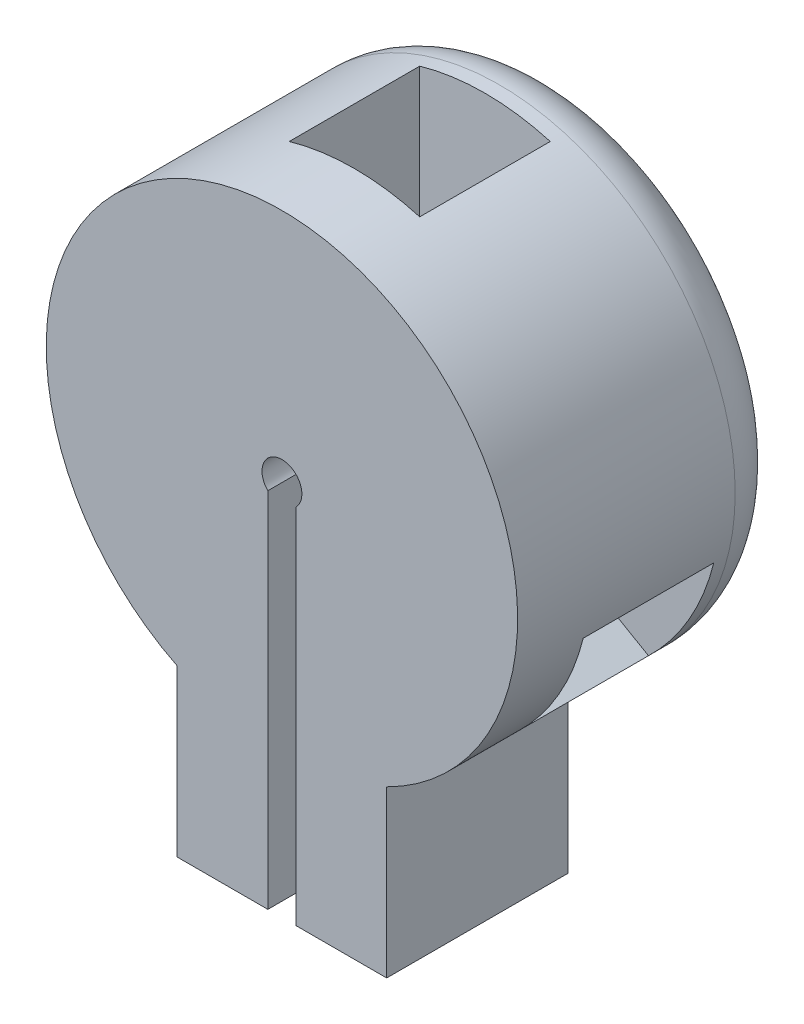
from build123d import *

# Parameters (mm, degrees)
BOSS_EXTRUDE1_DEPTH = 10
BOSS_EXTRUDE2_START = -5
SKETCH1_4_R         = 13
BOSS_EXTRUDE2_DEPTH = 5
FILLET1_R           = 3
SKETCH4_W           = 7.2
SKETCH4_H           = 7.2
CUT_EXTRUDE1_DEPTH  = 10
CIRPATTERN1_COUNT   = 3


with BuildPart() as part:
    # Sketch1 → Boss-Extrude1 (new body)
    with BuildSketch(Plane.XY):
        with BuildLine():
            Line((-5.777817459, -20.777817459), (-0.777817459, -20.777817459))
            Line((-0.777817459, -20.777817459), (-0.777817459, -0.777817459))
            ThreePointArc((-0.777817459, -0.777817459), (0, 1.1), (0.777817459, -0.777817459))
            Line((0.777817459, -0.777817459), (0.777817459, -20.777817459))
            Line((0.777817459, -20.777817459), (5.777817459, -20.777817459))
            Line((5.777817459, -20.777817459), (5.777817459, -11.645463727))
            ThreePointArc((5.777817459, -11.645463727), (0, 13), (-5.777817459, -11.645463727))
            Line((-5.777817459, -11.645463727), (-5.777817459, -20.777817459))
        make_face()
    extrude(amount=BOSS_EXTRUDE1_DEPTH)

    # Sketch1<4> → Boss-Extrude2 (add)
    with BuildSketch(Plane.XY.offset(BOSS_EXTRUDE2_START)):
        Circle(SKETCH1_4_R)
    extrude(amount=BOSS_EXTRUDE2_DEPTH)

    # Fillet1
    fillet1_edges = [part.edges().sort_by_distance(p)[0] for p in [
        (-13, 0, -5),
    ]]
    fillet(fillet1_edges, radius=FILLET1_R)

    # Sketch4 → Cut-Extrude1 (cut)
    with BuildSketch(Plane(origin=(-11.286443879, -6.451305765, 0), x_dir=(0.499999999999998, -0.8660254037844398, 0), z_dir=(0.8660254037844398, 0.499999999999998, 0))):
        with Locations((0.056227259, -2.4)):
            Rectangle(SKETCH4_W, SKETCH4_H)
    cut_extrude1 = extrude(amount=CUT_EXTRUDE1_DEPTH, mode=Mode.SUBTRACT)

    # CirPattern1: Cut-Extrude1 ×3 about axis
    cirpattern1_axis = Axis((0, 0, 10), (0, 0, -1))
    for i in range(1, CIRPATTERN1_COUNT):
        add(cut_extrude1.rotate(cirpattern1_axis, i * 360 / CIRPATTERN1_COUNT), mode=Mode.SUBTRACT)


solid = part.part
